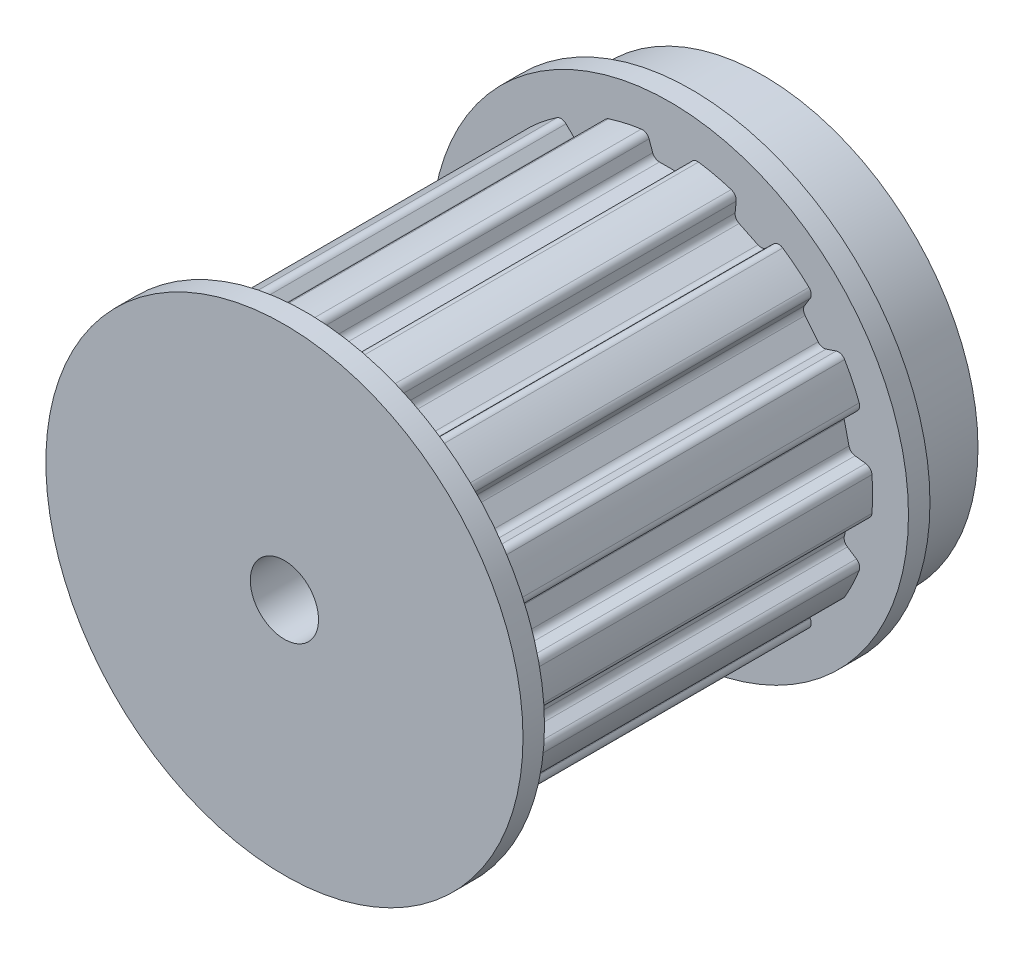
from build123d import *

# Parameters (mm, degrees)
CUT_EXTRUDE3_START       = -3
CUT_EXTRUDE3_DEPTH       = 50.8
FILLET1_R                = 1
CIRPATTERN1_COUNT        = 14
FILLET1_OF_CIRPATTERN1_R = 1
SKETCH3_R                = 4.7625
CUT_EXTRUDE4_DEPTH       = 82.729555004
SKETCH4_R                = 2
CUT_EXTRUDE5_DEPTH       = 82.729555004
SKETCH6_R                = 2
CUT_EXTRUDE6_DEPTH       = 82.729555086


with BuildPart() as part:
    # Sketch1 → Revolve1 (revolve)
    with BuildSketch(Plane(origin=(0, 0, 0), x_dir=(1, 0, 0), z_dir=(0, 1, 0)), mode=Mode.PRIVATE) as revolve1_sk:
        Polygon((0, 0), (0, 66.8), (-30, 66.8), (-30, 56.8), (-33.297748882, 56.8), (-33.297748882, 53.8), (-28.297748882, 53.8), (-28.297748882, 3), (-33.297748882, 3), (-33.297748882, 0), align=None)
    revolve(revolve1_sk.sketch.rotate(Axis((0, 0, 0), (0, 0, -1)), 180), axis=Axis((0, 0, 0), (0, 0, -1)))

    # Sketch2 → Cut-Extrude3 (cut)
    with BuildSketch(Plane.XY.offset(CUT_EXTRUDE3_START)):
        Polygon((-4.341910703, 31.297748882), (-2.158089297, 25.297748882), (2.158089297, 25.297748882), (4.341910703, 31.297748882), align=None)
    cut_extrude3 = extrude(amount=-CUT_EXTRUDE3_DEPTH, mode=Mode.SUBTRACT)

    # Fillet1
    fillet1_edges = [part.edges().sort_by_distance(p)[0] for p in [
        (-3.184571403, 28.11798529, -28.4),
        (-2.158089297, 25.297748882, -28.4),
        (3.184571403, 28.11798529, -28.4),
        (2.158089297, 25.297748882, -28.4),
    ]]
    fillet(fillet1_edges, radius=FILLET1_R)

    # CirPattern1: Cut-Extrude3 ×14 about axis
    cirpattern1_axis = Axis((0, 0, 0), (0, 0, 1))
    for i in range(1, CIRPATTERN1_COUNT):
        add(cut_extrude3.rotate(cirpattern1_axis, i * 360 / CIRPATTERN1_COUNT), mode=Mode.SUBTRACT)

    # Fillet1 of CirPattern1
    fillet1_of_cirpattern1_edges = [part.edges().sort_by_distance(p)[0] for p in [
        (-15.069136286, 23.951695626, -28.4),
        (-12.920653147, 21.856124317, -28.4),
        (-9.330736902, 26.715163122, -28.4),
        (-9.031910605, 23.728844024, -28.4),
        (-23.969073916, 15.041478896, -28.4),
        (-21.12412318, 14.085626283, -28.4),
        (-19.99797833, 20.021075258, -28.4),
        (-18.433029843, 17.460150592, -28.4),
        (-28.121642496, 3.152112798, -28.4),
        (-25.143701546, 3.525297215, -28.4),
        (-26.70437489, 9.361567897, -28.4),
        (-24.183261454, 7.733260201, -28.4),
        (-26.70437489, -9.361567897, -28.4),
        (-24.183261454, -7.733260201, -28.4),
        (-28.121642496, -3.152112798, -28.4),
        (-25.143701546, -3.525297215, -28.4),
        (-19.99797833, -20.021075258, -28.4),
        (-18.433029843, -17.460150592, -28.4),
        (-23.969073916, -15.041478896, -28.4),
        (-21.12412318, -14.085626283, -28.4),
        (-9.330736902, -26.715163122, -28.4),
        (-9.031910605, -23.728844024, -28.4),
        (-15.069136286, -23.951695626, -28.4),
        (-12.920653147, -21.856124317, -28.4),
        (3.184571403, -28.11798529, -28.4),
        (2.158089297, -25.297748882, -28.4),
        (-3.184571403, -28.11798529, -28.4),
        (-2.158089297, -25.297748882, -28.4),
        (15.069136286, -23.951695626, -28.4),
        (12.920653147, -21.856124317, -28.4),
        (9.330736902, -26.715163122, -28.4),
        (9.031910605, -23.728844024, -28.4),
        (23.969073916, -15.041478896, -28.4),
        (21.12412318, -14.085626283, -28.4),
        (19.99797833, -20.021075258, -28.4),
        (18.433029843, -17.460150592, -28.4),
        (28.121642496, -3.152112798, -28.4),
        (25.143701546, -3.525297215, -28.4),
        (26.70437489, -9.361567897, -28.4),
        (24.183261454, -7.733260201, -28.4),
        (26.70437489, 9.361567897, -28.4),
        (24.183261454, 7.733260201, -28.4),
        (28.121642496, 3.152112798, -28.4),
        (25.143701546, 3.525297215, -28.4),
        (19.99797833, 20.021075258, -28.4),
        (18.433029843, 17.460150592, -28.4),
        (23.969073916, 15.041478896, -28.4),
        (21.12412318, 14.085626283, -28.4),
        (9.330736902, 26.715163122, -28.4),
        (9.031910605, 23.728844024, -28.4),
        (15.069136286, 23.951695626, -28.4),
        (12.920653147, 21.856124317, -28.4),
    ]]
    fillet(fillet1_of_cirpattern1_edges, radius=FILLET1_OF_CIRPATTERN1_R)

    # Sketch3 → Cut-Extrude4 (cut, through all)
    with BuildSketch(Plane(origin=(0, 0, -66.8), x_dir=(-1, 0, 0), z_dir=(0, 0, -1))):
        Circle(SKETCH3_R)
    extrude(amount=-CUT_EXTRUDE4_DEPTH, mode=Mode.SUBTRACT)

    # Sketch4 → Cut-Extrude5 (cut, through all)
    with BuildSketch(Plane(origin=(0, 0, 0), x_dir=(1, 0, 0), z_dir=(0, 1, 0))):
        with Locations(Location((0, 61.8, 0), (0, 0, 270))):
            Circle(SKETCH4_R)
    extrude(amount=-CUT_EXTRUDE5_DEPTH, mode=Mode.SUBTRACT)

    # Sketch6 → Cut-Extrude6 (cut, through all)
    with BuildSketch(Plane(origin=(0, 0, 0), x_dir=(0, 0, -1), z_dir=(1, 0, 0))):
        with Locations((61.8, 0)):
            Circle(SKETCH6_R)
    extrude(amount=-CUT_EXTRUDE6_DEPTH, mode=Mode.SUBTRACT)


solid = part.part
